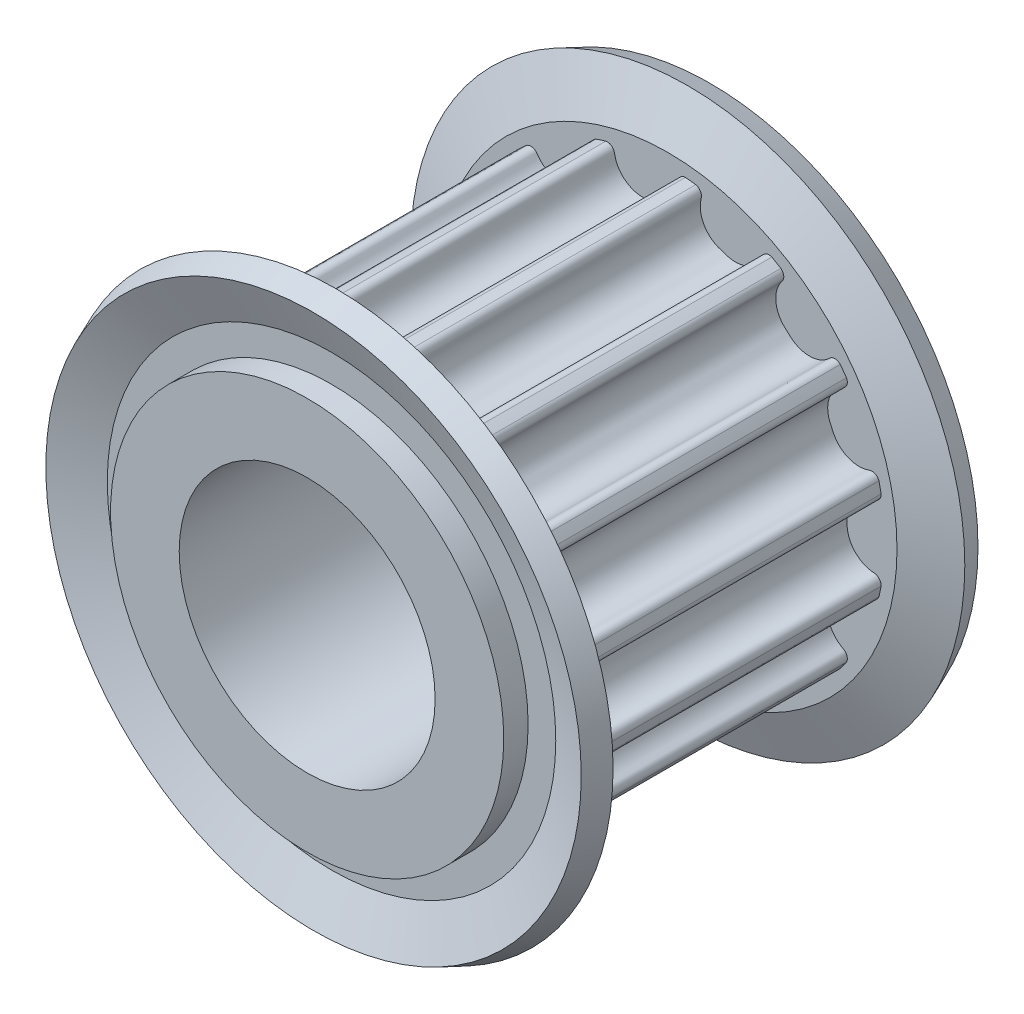
from build123d import *

# Parameters (mm, degrees)
TOOTHEXTRUDECUTGEARBELT01PULLEY_DEPTH = 4.876799927
PATTERNGEARBELT01PULLEY_COUNT         = 15
BOREREVOLVESKETCH_W                   = 12.801599808
BOREREVOLVESKETCH_H                   = 4


with BuildPart() as part:
    # SketchRevolveGearBelt01Pulley → GearBelt01Pulley (revolve)
    with BuildSketch(Plane(origin=(0, 0, 0), x_dir=(0, 0, -1), z_dir=(1, 0, 0)), mode=Mode.PRIVATE) as gearbelt01pulley_sk:
        Polygon((6.400799904, 0), (6.400799904, 6.145458216), (5.638799915, 6.145458216), (5.638799915, 7.009886979), (6.201536555, 8.368453407), (5.497540362, 8.660058178), (4.876799927, 7.161458201), (4.876799927, 6.780458207), (-4.876799927, 6.780458207), (-4.876799927, 7.161458201), (-5.497540362, 8.660058178), (-6.201536555, 8.368453407), (-5.638799915, 7.009886979), (-5.638799915, 6.145458216), (-6.400799904, 6.145458216), (-6.400799904, 0), align=None)
    revolve(gearbelt01pulley_sk.sketch.rotate(Axis((0, 0, 0), (0, 0, -1)), 90), axis=Axis((0, 0, 0), (0, 0, -1)))

    # SketchToothGearBelt01Pulley → ToothExtrudeCutGearBelt01Pulley (cut, symmetric)
    with BuildSketch(Plane.XY):
        with BuildLine():
            ThreePointArc((6.661096355, 1.272831888), (6.78161527, 0), (6.661096355, -1.272831888))
            add(Edge.make_bspline(
                [(6.661096355, -1.272831888), (6.663615018, -1.259659662), (6.665647801, -1.239568599), (6.664820876, -1.212733988), (6.662437583, -1.192740045), (6.658309361, -1.173032278), (6.652468102, -1.15376267), (6.644958835, -1.135079815), (6.635839471, -1.117127785), (6.625180333, -1.100045019), (6.613063619, -1.083963244), (6.599582765, -1.06900649), (6.584841733, -1.055290043), (6.568954182, -1.042919864), (6.552042687, -1.031990656), (6.534237438, -1.022589264), (6.515676569, -1.014778616), (6.49650012, -1.00865466), (6.476867505, -1.00413133), (6.427750984, -0.998255219), (6.361870769, -0.993498048), (6.280955314, -0.976758348), (6.213857662, -0.957771629), (6.148468462, -0.93346319), (6.085179943, -0.904141421), (6.024383488, -0.869943856), (5.966451939, -0.831092016), (5.9117414, -0.787821543), (5.860587957, -0.740399103), (5.813305895, -0.689115832), (5.770185727, -0.634286865), (5.731492294, -0.576249049), (5.697463629, -0.515358957), (5.668307661, -0.451990704), (5.644207759, -0.386533555), (5.625296172, -0.319389892), (5.611748114, -0.250971402), (5.603426544, -0.18170154), (5.601350103, -0.116556682), (5.601805881, -0.056000917), (5.601665396, 0), (5.601805881, 0.056000917), (5.601350103, 0.116556682), (5.603426544, 0.18170154), (5.611748114, 0.250971402), (5.625296172, 0.319389892), (5.644207759, 0.386533555), (5.668307661, 0.451990704), (5.697463629, 0.515358957), (5.731492294, 0.576249049), (5.770185727, 0.634286865), (5.813305895, 0.689115832), (5.860587957, 0.740399103), (5.9117414, 0.787821543), (5.966451939, 0.831092016), (6.024383488, 0.869943856), (6.085179943, 0.904141421), (6.148468462, 0.93346319), (6.213857662, 0.957771629), (6.280955314, 0.976758348), (6.361870769, 0.993498048), (6.427750984, 0.998255219), (6.476867505, 1.00413133), (6.49650012, 1.00865466), (6.515676569, 1.014778616), (6.534237438, 1.022589264), (6.552042687, 1.031990656), (6.568954182, 1.042919864), (6.584841733, 1.055290043), (6.599582765, 1.06900649), (6.613063619, 1.083963244), (6.625180333, 1.100045019), (6.635839471, 1.117127785), (6.644958835, 1.135079815), (6.652468102, 1.15376267), (6.658309361, 1.173032278), (6.662437583, 1.192740045), (6.664820876, 1.212733988), (6.665647801, 1.239568599), (6.663615018, 1.259659662), (6.661096355, 1.272831888)],
                knots=[0, 0, 0, 0, 0.010832325, 0.016248488, 0.021664651, 0.027080813, 0.032496976, 0.037913139, 0.043329302, 0.048745464, 0.054161627, 0.05957779, 0.064993952, 0.070410115, 0.075826278, 0.08124244, 0.086658603, 0.092074766, 0.097490929, 0.102907091, 0.132017291, 0.150784932, 0.169552572, 0.188320213, 0.207087853, 0.225855493, 0.244623134, 0.263390774, 0.282158415, 0.300926055, 0.319693695, 0.338461336, 0.357228976, 0.375996617, 0.394764257, 0.413531897, 0.432299538, 0.451067178, 0.469834819, 0.484917409, 0.5, 0.515082591, 0.530165181, 0.548932822, 0.567700462, 0.586468103, 0.605235743, 0.624003383, 0.642771024, 0.661538664, 0.680306305, 0.699073945, 0.717841585, 0.736609226, 0.755376866, 0.774144507, 0.792912147, 0.811679787, 0.830447428, 0.849215068, 0.867982709, 0.897092909, 0.902509071, 0.907925234, 0.913341397, 0.91875756, 0.924173722, 0.929589885, 0.935006048, 0.94042221, 0.945838373, 0.951254536, 0.956670698, 0.962086861, 0.967503024, 0.972919187, 0.978335349, 0.983751512, 0.989167675, 1, 1, 1, 1], degree=3))
        make_face()
    toothextrudecutgearbelt01pulley = extrude(amount=TOOTHEXTRUDECUTGEARBELT01PULLEY_DEPTH, both=True, mode=Mode.SUBTRACT)

    # PatternGearBelt01Pulley: ToothExtrudeCutGearBelt01Pulley ×15 about axis
    patterngearbelt01pulley_axis = Axis((0, 0, 55), (0, 0, -1))
    for i in range(1, PATTERNGEARBELT01PULLEY_COUNT):
        add(toothextrudecutgearbelt01pulley.rotate(patterngearbelt01pulley_axis, i * 360 / PATTERNGEARBELT01PULLEY_COUNT), mode=Mode.SUBTRACT)

    # BoreRevolveSketch → BoreRevolveCut (revolve, cut)
    with BuildSketch(Plane(origin=(0, 0, 0), x_dir=(0, 0, -1), z_dir=(1, 0, 0)), mode=Mode.PRIVATE) as borerevolvecut_sk:
        with Locations((0, 2)):
            Rectangle(BOREREVOLVESKETCH_W, BOREREVOLVESKETCH_H)
    revolve(borerevolvecut_sk.sketch.rotate(Axis((0, 0, 0), (0, 0, -1)), 90), axis=Axis((0, 0, 0), (0, 0, -1)), mode=Mode.SUBTRACT)


solid = part.part
